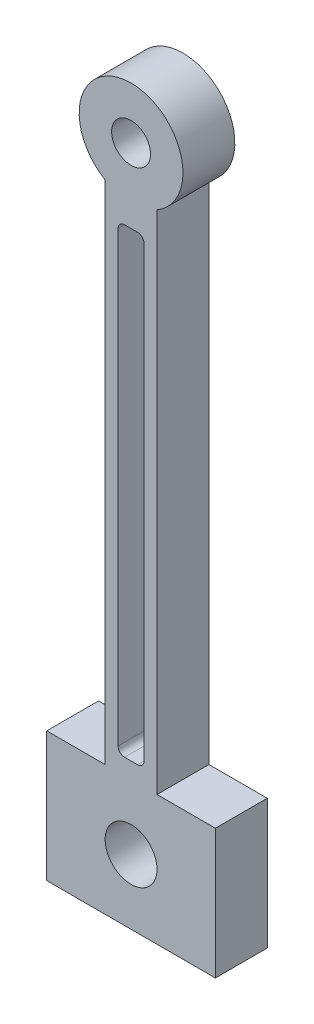
from build123d import *

# Parameters (mm, degrees)
SKETCH1_R           = 6
SKETCH1_R_2         = 5
SKETCH1_R_3         = 3
SKETCH1_R_4         = 4
BOSS_EXTRUDE1_DEPTH = 8


with BuildPart() as part:
    # Sketch1 → Boss-Extrude1 (new body)
    # profile 1 of 3: a face of its own
    with BuildSketch(Plane.XY):
        with BuildLine():
            Line((4, -6.92820323), (4, -85))
            Line((4, -85), (13, -85))
            Line((13, -85), (13, -105))
            Line((13, -105), (-13, -105))
            Line((-13, -105), (-13, -85))
            Line((-13, -85), (-4, -85))
            Line((-4, -85), (-4, -6.92820323))
            ThreePointArc((-4, -6.92820323), (0, 8), (4, -6.92820323))
        make_face()
        with Locations((0, -95)):
            Circle(SKETCH1_R, mode=Mode.SUBTRACT)
        Circle(SKETCH1_R_2, mode=Mode.SUBTRACT)
        with BuildLine():
            Line((-2, -12.430963228), (-2, -81.520541763))
            ThreePointArc((-2, -81.520541763), (-1.707106781, -82.227648544), (-1, -82.520541763))
            Line((-1, -82.520541763), (1, -82.520541763))
            ThreePointArc((1, -82.520541763), (1.707106781, -82.227648544), (2, -81.520541763))
            Line((2, -81.520541763), (2, -12.430963228))
            ThreePointArc((2, -12.430963228), (1.707106781, -11.723856446), (1, -11.430963228))
            Line((1, -11.430963228), (-1, -11.430963228))
            ThreePointArc((-1, -11.430963228), (-1.707106781, -11.723856446), (-2, -12.430963228))
        make_face(mode=Mode.SUBTRACT)
    # profile 2 of 3: a face of its own
    with BuildSketch(Plane.XY):
        Circle(SKETCH1_R_2)
        Circle(SKETCH1_R_3, mode=Mode.SUBTRACT)
    # profile 3 of 3: a face of its own
    with BuildSketch(Plane.XY):
        with Locations((0, -95)):
            Circle(SKETCH1_R)
        with Locations((0, -95)):
            Circle(SKETCH1_R_4, mode=Mode.SUBTRACT)
    extrude(amount=BOSS_EXTRUDE1_DEPTH)


solid = part.part
